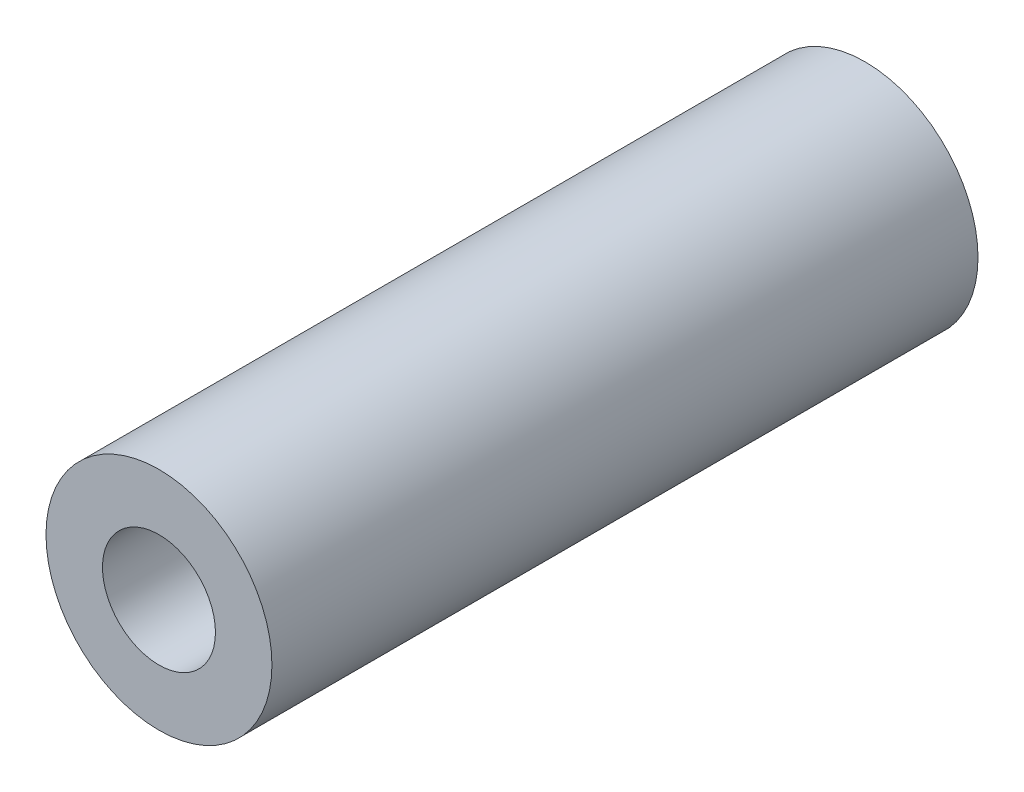
from build123d import *

# Parameters (mm, degrees)
SKETCH_1_R          = 8
EXTRUDE_1_DEPTH     = 50
SKETCH_2_R          = 4
CUT_EXTRUDE_1_DEPTH = 30


with BuildPart() as part:
    # 스케치1 → 보스-돌출1 (new body)
    with BuildSketch(Plane.XY):
        Circle(SKETCH_1_R)
    extrude(amount=EXTRUDE_1_DEPTH)

    # 스케치2 → 컷-돌출1 (cut)
    with BuildSketch(Plane.XY.offset(50)):
        Circle(SKETCH_2_R)
    extrude(amount=-CUT_EXTRUDE_1_DEPTH, mode=Mode.SUBTRACT)


solid = part.part
